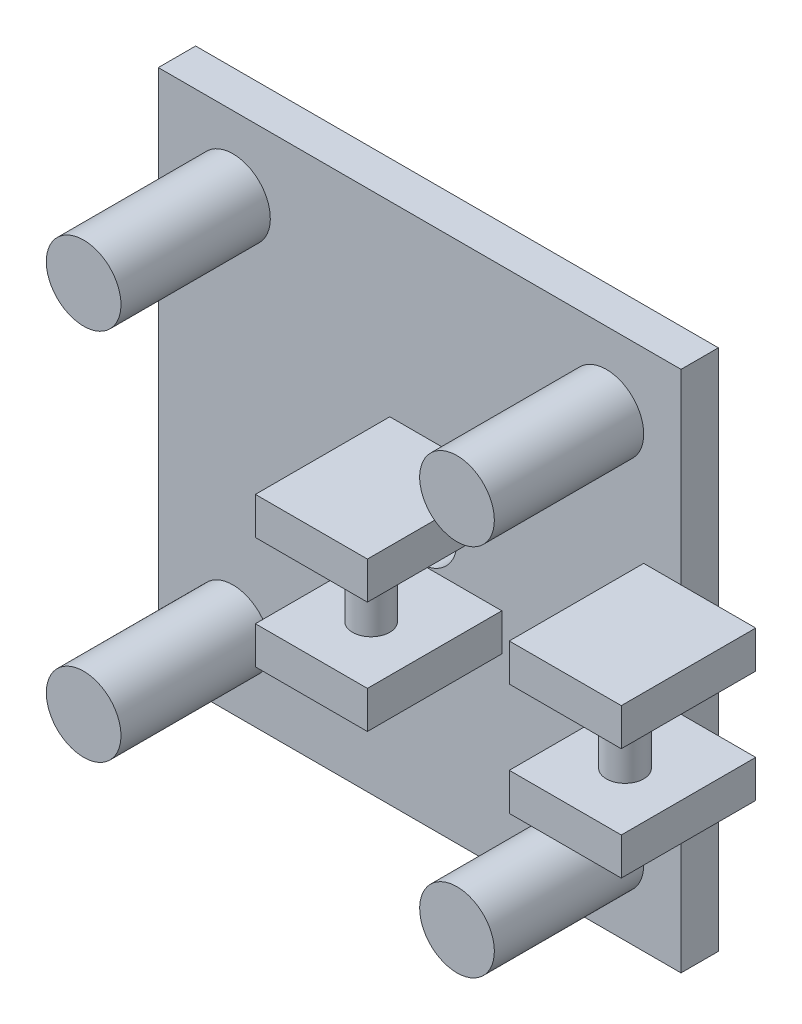
from build123d import *

# Parameters (mm, degrees)
SKETCH1_W           = 70
SKETCH1_H           = 70
SKETCH1_R           = 5
BOSS_EXTRUDE1_DEPTH = 5
SKETCH2_R           = 5
BOSS_EXTRUDE2_DEPTH = 20
CIRPATTERN1_COUNT   = 4
SKETCH3_W           = 15
SKETCH3_H           = 5
BOSS_EXTRUDE3_DEPTH = 18
SKETCH4_R           = 2.5
BOSS_EXTRUDE4_DEPTH = 20


with BuildPart() as part:
    # Sketch1 → Boss-Extrude1 (new body)
    with BuildSketch(Plane.XY):
        Rectangle(SKETCH1_W, SKETCH1_H)
        Circle(SKETCH1_R, mode=Mode.SUBTRACT)
    extrude(amount=BOSS_EXTRUDE1_DEPTH)

    # Sketch2 → Boss-Extrude2 (add)
    with BuildSketch(Plane.XY.offset(5)):
        with Locations((25, 25)):
            Circle(SKETCH2_R)
    boss_extrude2 = extrude(amount=BOSS_EXTRUDE2_DEPTH)

    # CirPattern1: Boss-Extrude2 ×4 about axis
    cirpattern1_axis = Axis((0, 0, 0), (0, 0, 1))
    for i in range(1, CIRPATTERN1_COUNT):
        add(boss_extrude2.rotate(cirpattern1_axis, i * 360 / CIRPATTERN1_COUNT))

    # Sketch3 → Boss-Extrude3 (add)
    with BuildSketch(Plane.XY.offset(5)):
        with Locations((3.5, -7.5)):
            Rectangle(SKETCH3_W, SKETCH3_H)
        with Locations((3.5, 7.5)):
            Rectangle(SKETCH3_W, SKETCH3_H)
        with Locations((37.5, -7.5)):
            Rectangle(SKETCH3_W, SKETCH3_H)
        with Locations((37.5, 7.5)):
            Rectangle(SKETCH3_W, SKETCH3_H)
    extrude(amount=BOSS_EXTRUDE3_DEPTH)

    # Sketch4 → Boss-Extrude4 (add)
    with BuildSketch(Plane(origin=(0, 10, 0), x_dir=(1, 0, 0), z_dir=(0, 1, 0))):
        with Locations(Location((3.5, -15, 0), (0, 0, 270))):
            Circle(SKETCH4_R)
        with Locations(Location((37.5, -15, 0), (0, 0, 270))):
            Circle(SKETCH4_R)
    extrude(amount=-BOSS_EXTRUDE4_DEPTH)


solid = part.part
